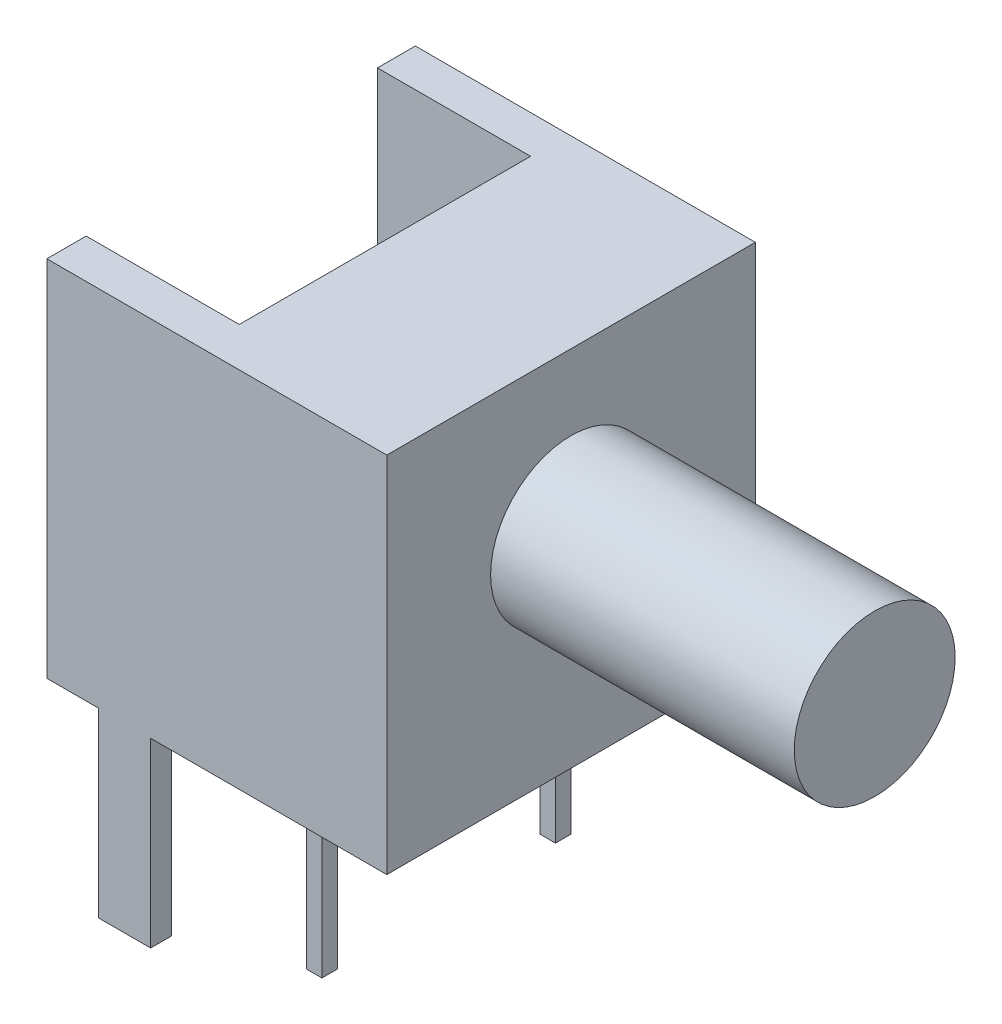
from build123d import *

# Parameters (mm, degrees)
SKETCH1_W           = 7.1
SKETCH1_H           = 7
BOSS_EXTRUDE1_DEPTH = 6.55
SKETCH2_W           = 0.3
SKETCH2_H           = 0.3
SKETCH2_W_2         = 1
SKETCH2_H_2         = 0.4
BOSS_EXTRUDE2_DEPTH = 3.5
SKETCH3_W           = 2.95
SKETCH3_H           = 5.612486488
CUT_EXTRUDE1_DEPTH  = 13.874587372
SKETCH4_R           = 1.55
BOSS_EXTRUDE3_DEPTH = 5.85


with BuildPart() as part:
    # Sketch1 → Boss-Extrude1 (new body)
    with BuildSketch(Plane(origin=(0, 0, 0), x_dir=(0, 0, -1), z_dir=(1, 0, 0))):
        Rectangle(SKETCH1_W, SKETCH1_H)
    extrude(amount=-BOSS_EXTRUDE1_DEPTH)

    # Sketch2 → Boss-Extrude2 (add)
    with BuildSketch(Plane.XZ.offset(3.5)):
        with Locations((-2.55, 2.25)):
            Rectangle(SKETCH2_W, SKETCH2_H)
        with Locations((-5.05, 3.35)):
            Rectangle(SKETCH2_W_2, SKETCH2_H_2)
    boss_extrude2 = extrude(amount=BOSS_EXTRUDE2_DEPTH)

    # Mirror1: Boss-Extrude2 across plane
    add(boss_extrude2.mirror(Plane.XY))

    # Sketch3 → Cut-Extrude1 (cut, through all)
    with BuildSketch(Plane(origin=(0, 3.5, 0), x_dir=(1, 0, 0), z_dir=(0, 1, 0))):
        with Locations((-5.075, 0.013867293)):
            Rectangle(SKETCH3_W, SKETCH3_H)
    extrude(amount=-CUT_EXTRUDE1_DEPTH, mode=Mode.SUBTRACT)

    # Sketch4 → Boss-Extrude3 (add)
    with BuildSketch(Plane(origin=(0, 0, 0), x_dir=(0, 0, -1), z_dir=(1, 0, 0))):
        with Locations(Location((0, 0.5, 0), (0, 0, 180))):
            Circle(SKETCH4_R)
    extrude(amount=BOSS_EXTRUDE3_DEPTH)


solid = part.part
